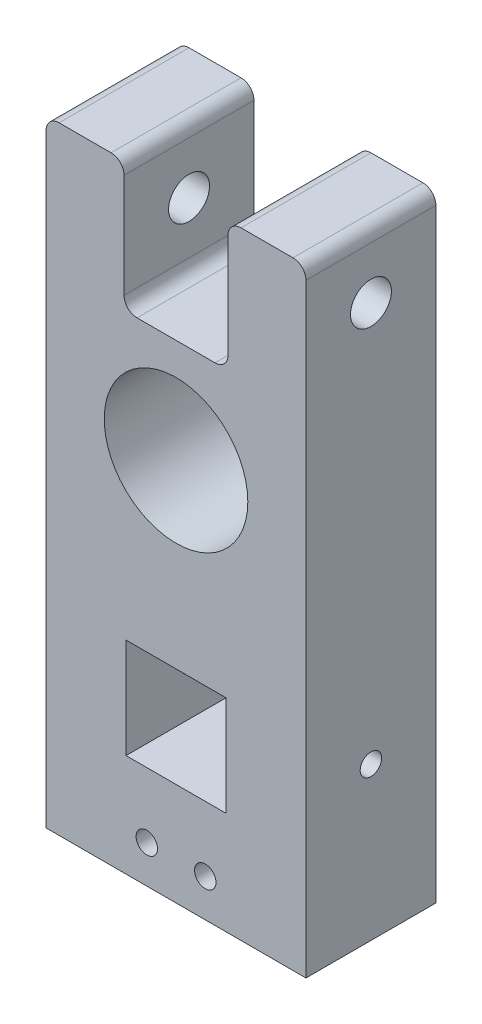
from build123d import *

# Parameters (mm, degrees)
SKETCH_1_W          = 40
SKETCH_1_H          = 95
EXTRUDE_1_DEPTH     = 20
SKETCH_2_R          = 3.15
CUT_EXTRUDE_1_DEPTH = 500
SKETCH_4_W          = 16
SKETCH_4_H          = 24.328759663
CUT_EXTRUDE_2_DEPTH = 500
SKETCH_5_R          = 11.05
CUT_EXTRUDE_3_DEPTH = 20
SKETCH_6_W          = 15.4
SKETCH_6_H          = 15.4
CUT_EXTRUDE_4_DEPTH = 20
SKETCH_7_R          = 1.65
CUT_EXTRUDE_5_DEPTH = 20
SKETCH_8_R          = 1.65
CUT_EXTRUDE_6_DEPTH = 50
FILLET_1_R          = 2


with BuildPart() as part:
    # 草图1 → 凸台-拉伸1 (new body)
    with BuildSketch(Plane.XY):
        with Locations((0, -0.95)):
            Rectangle(SKETCH_1_W, SKETCH_1_H)
    extrude(amount=EXTRUDE_1_DEPTH)

    # 草图2 → 切除-拉伸1 (cut)
    with BuildSketch(Plane(origin=(20, 0, 0), x_dir=(0, 0, -1), z_dir=(1, 0, 0))):
        with Locations((-10, 36.55)):
            Circle(SKETCH_2_R)
    extrude(amount=-CUT_EXTRUDE_1_DEPTH, mode=Mode.SUBTRACT)

    # 草图4 → 切除-拉伸2 (cut)
    with BuildSketch(Plane.XY.offset(20)):
        with Locations((0, 38.714379832)):
            Rectangle(SKETCH_4_W, SKETCH_4_H)
    extrude(amount=-CUT_EXTRUDE_2_DEPTH, mode=Mode.SUBTRACT)

    # 草图5 → 切除-拉伸3 (cut)
    with BuildSketch(Plane.XY.offset(20)):
        with Locations((0, 10.55)):
            Circle(SKETCH_5_R)
    extrude(amount=-CUT_EXTRUDE_3_DEPTH, mode=Mode.SUBTRACT)

    # 草图6 → 切除-拉伸4 (cut)
    with BuildSketch(Plane(origin=(0, 0, 0), x_dir=(-1, 0, 0), z_dir=(0, 0, -1))):
        with Locations((0, -24.95)):
            Rectangle(SKETCH_6_W, SKETCH_6_H)
    extrude(amount=-CUT_EXTRUDE_4_DEPTH, mode=Mode.SUBTRACT)

    # 草图7 → 切除-拉伸5 (cut)
    with BuildSketch(Plane(origin=(0, 0, 0), x_dir=(-1, 0, 0), z_dir=(0, 0, -1))):
        with Locations((4.5, -42.65)):
            Circle(SKETCH_7_R)
        with Locations((-4.5, -42.65)):
            Circle(SKETCH_7_R)
    extrude(amount=-CUT_EXTRUDE_5_DEPTH, mode=Mode.SUBTRACT)

    # 草图8 → 切除-拉伸6 (cut)
    with BuildSketch(Plane(origin=(20, 0, 0), x_dir=(0, 0, -1), z_dir=(1, 0, 0))):
        with Locations((-10, -24.95)):
            Circle(SKETCH_8_R)
    extrude(amount=-CUT_EXTRUDE_6_DEPTH, mode=Mode.SUBTRACT)

    # 圆角1
    fillet_1_edges = [part.edges().sort_by_distance(p)[0] for p in [
        (8, 46.55, 10),
        (-8, 46.55, 10),
        (-8, 26.55, 10),
        (8, 26.55, 10),
        (-20, 46.55, 10),
        (20, 46.55, 10),
    ]]
    fillet(fillet_1_edges, radius=FILLET_1_R)


solid = part.part
